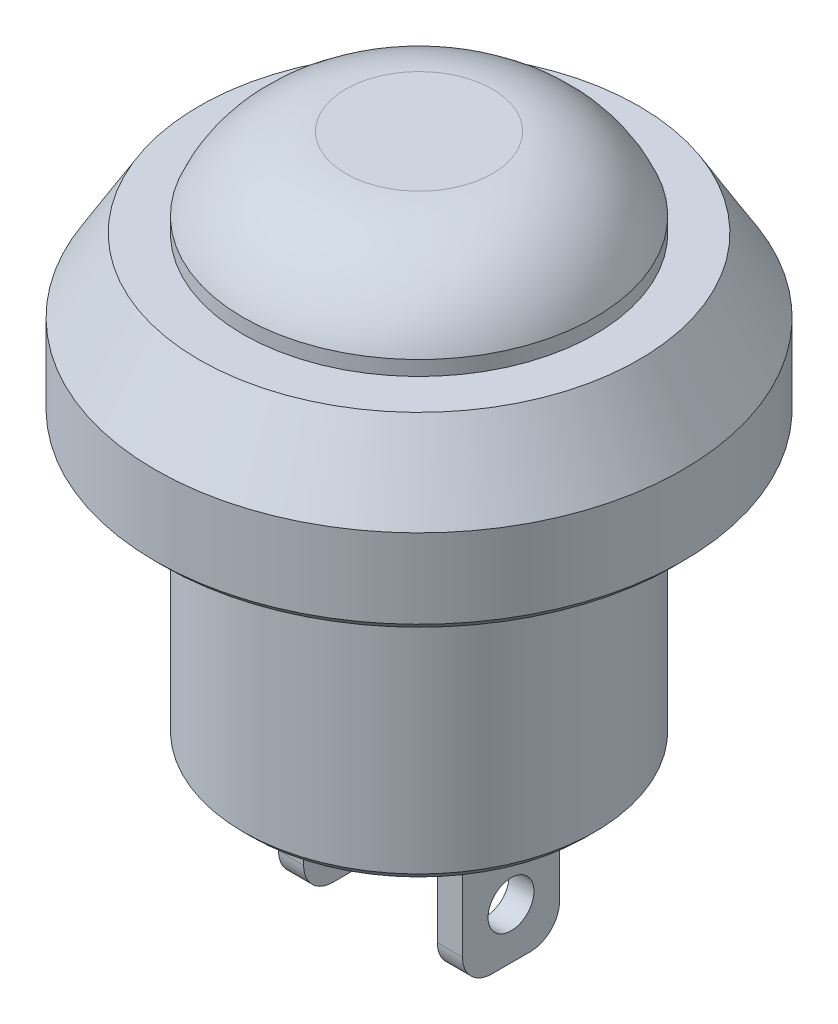
from build123d import *

# Parameters (mm, degrees)
CHAMFER1_SIZE       = 0.3
SKETCH2_W           = 0.855522376
SKETCH2_H           = 3.315149208
BOSS_EXTRUDE1_DEPTH = 5
SKETCH3_R           = 0.78364852
CUT_EXTRUDE1_DEPTH  = 12
FILLET1_R           = 1


with BuildPart() as part:
    # Sketch1 → Revolve1 (revolve)
    with BuildSketch(Plane.XY, mode=Mode.PRIVATE) as revolve1_sk:
        with BuildLine():
            Line((0, 0), (2.5, 0))
            ThreePointArc((2.5, 0), (4.614619792, -0.739532292), (6, -2.5))
            Line((6, -2.5), (6, -3))
            Line((6, -3), (7.5, -3))
            Line((7.5, -3), (9, -5.5))
            Line((9, -5.5), (9, -8.5))
            Line((9, -8.5), (6, -8.5))
            Line((6, -8.5), (6, -18))
            Line((6, -18), (0, -18))
            Line((0, -18), (0, 0))
        make_face()
    revolve(revolve1_sk.sketch.rotate(Axis((0, 0, 0), (0, -1, 0)), 90), axis=Axis((0, 0, 0), (0, -1, 0)))

    # Chamfer1
    chamfer1_edges = [part.edges().sort_by_distance(p)[0] for p in [
        (0, -8.5, -6),
        (0, -18, -6),
        (0, -8.5, -9),
    ]]
    chamfer(chamfer1_edges, length=CHAMFER1_SIZE)

    # Sketch2 → Boss-Extrude1 (add)
    with BuildSketch(Plane.XZ.offset(18)):
        with Locations((2.709154191, 0)):
            Rectangle(SKETCH2_W, SKETCH2_H)
        with Locations((-2.709154191, 0)):
            Rectangle(SKETCH2_W, SKETCH2_H)
    extrude(amount=BOSS_EXTRUDE1_DEPTH)

    # Sketch3 → Cut-Extrude1 (cut)
    with BuildSketch(Plane.ZY.offset(3.136915379)):
        with Locations((0, -21.270184358)):
            Circle(SKETCH3_R)
    extrude(amount=-CUT_EXTRUDE1_DEPTH, mode=Mode.SUBTRACT)

    # Fillet1
    fillet1_edges = [part.edges().sort_by_distance(p)[0] for p in [
        (2.709154191, -23, 1.657574604),
        (2.709154191, -23, -1.657574604),
        (-2.709154191, -23, 1.657574604),
        (-2.709154191, -23, -1.657574604),
    ]]
    fillet(fillet1_edges, radius=FILLET1_R)


solid = part.part
